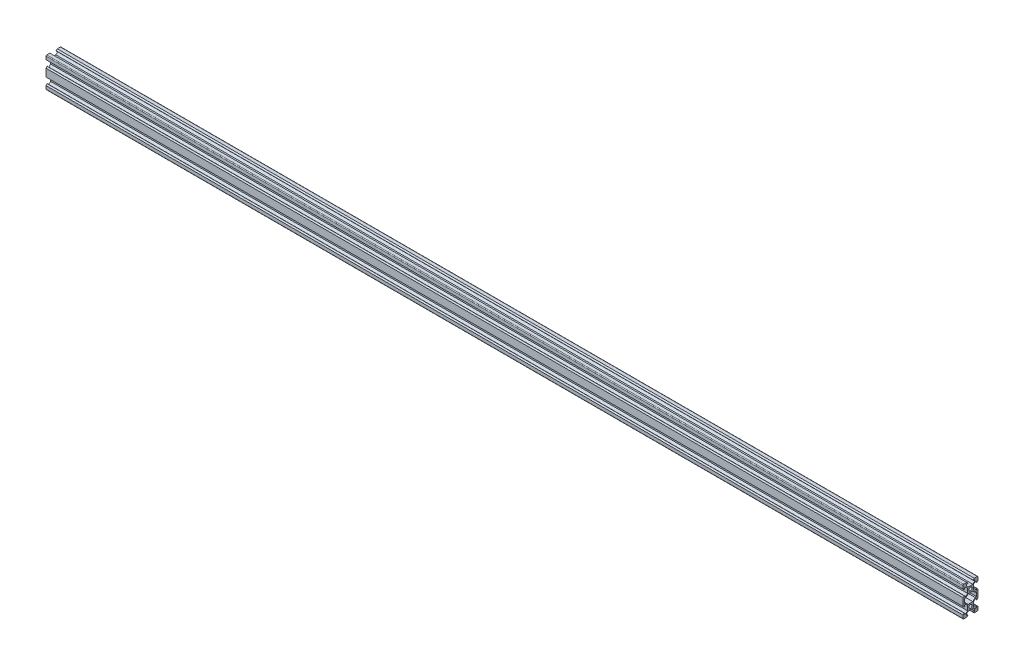
from build123d import *

# Parameters (mm, degrees)
SKETCH12_R             = 2.1
VSLOT2040_2040_2_DEPTH = 1219.2


with BuildPart() as part:
    # Sketch12 → Vslot2040 2040(2) (new body)
    with BuildSketch(Plane(origin=(-609.6, 0, 0), x_dir=(0, 0, -1), z_dir=(1, 0, 0))):
        with BuildLine():
            Line((5.5, -18.2), (3.607842712, -18.2))
            ThreePointArc((3.607842712, -18.2), (3.423066806, -18.323463314), (3.466421356, -18.541421356))
            Line((3.466421356, -18.541421356), (4.925, -20))
            Line((4.925, -20), (9, -20))
            ThreePointArc((9, -20), (9.707106781, -19.707106781), (10, -19))
            Line((10, -19), (10, -14.925))
            Line((10, -14.925), (8.541421356, -13.466421356))
            ThreePointArc((8.541421356, -13.466421356), (8.323463314, -13.423066806), (8.2, -13.607842712))
            Line((8.2, -13.607842712), (8.2, -15.5))
            Line((8.2, -15.5), (6.275, -15.5))
            Line((6.275, -15.5), (3.9, -13.125))
            Line((3.9, -13.125), (3.9, -6.875))
            Line((3.9, -6.875), (6.275, -4.5))
            Line((6.275, -4.5), (8.2, -4.5))
            Line((8.2, -4.5), (8.2, -6.392157288))
            ThreePointArc((8.2, -6.392157288), (8.323463314, -6.576933194), (8.541421356, -6.533578644))
            Line((8.541421356, -6.533578644), (10, -5.075))
            Line((10, -5.075), (10, 5.075))
            Line((10, 5.075), (8.541421356, 6.533578644))
            ThreePointArc((8.541421356, 6.533578644), (8.323463314, 6.576933194), (8.2, 6.392157288))
            Line((8.2, 6.392157288), (8.2, 4.5))
            Line((8.2, 4.5), (6.275, 4.5))
            Line((6.275, 4.5), (3.9, 6.875))
            Line((3.9, 6.875), (3.9, 13.125))
            Line((3.9, 13.125), (6.275, 15.5))
            Line((6.275, 15.5), (8.2, 15.5))
            Line((8.2, 15.5), (8.2, 13.607842712))
            ThreePointArc((8.2, 13.607842712), (8.323463314, 13.423066806), (8.541421356, 13.466421356))
            Line((8.541421356, 13.466421356), (10, 14.925))
            Line((10, 14.925), (10, 19))
            ThreePointArc((10, 19), (9.707106781, 19.707106781), (9, 20))
            Line((9, 20), (4.925, 20))
            Line((4.925, 20), (3.466421356, 18.541421356))
            ThreePointArc((3.466421356, 18.541421356), (3.423066806, 18.323463314), (3.607842712, 18.2))
            Line((3.607842712, 18.2), (5.5, 18.2))
            Line((5.5, 18.2), (5.5, 16.275))
            Line((5.5, 16.275), (3.125, 13.9))
            Line((3.125, 13.9), (-3.125, 13.9))
            Line((-3.125, 13.9), (-5.5, 16.275))
            Line((-5.5, 16.275), (-5.5, 18.2))
            Line((-5.5, 18.2), (-3.607842712, 18.2))
            ThreePointArc((-3.607842712, 18.2), (-3.423066806, 18.323463314), (-3.466421356, 18.541421356))
            Line((-3.466421356, 18.541421356), (-4.925, 20))
            Line((-4.925, 20), (-9, 20))
            ThreePointArc((-9, 20), (-9.707106781, 19.707106781), (-10, 19))
            Line((-10, 19), (-10, 14.925))
            Line((-10, 14.925), (-8.541421356, 13.466421356))
            ThreePointArc((-8.541421356, 13.466421356), (-8.323463314, 13.423066806), (-8.2, 13.607842712))
            Line((-8.2, 13.607842712), (-8.2, 15.5))
            Line((-8.2, 15.5), (-6.275, 15.5))
            Line((-6.275, 15.5), (-3.9, 13.125))
            Line((-3.9, 13.125), (-3.9, 6.875))
            Line((-3.9, 6.875), (-6.275, 4.5))
            Line((-6.275, 4.5), (-8.2, 4.5))
            Line((-8.2, 4.5), (-8.2, 6.392157288))
            ThreePointArc((-8.2, 6.392157288), (-8.323463314, 6.576933194), (-8.541421356, 6.533578644))
            Line((-8.541421356, 6.533578644), (-10, 5.075))
            Line((-10, 5.075), (-10, -5.075))
            Line((-10, -5.075), (-8.541421356, -6.533578644))
            ThreePointArc((-8.541421356, -6.533578644), (-8.323463314, -6.576933194), (-8.2, -6.392157288))
            Line((-8.2, -6.392157288), (-8.2, -4.5))
            Line((-8.2, -4.5), (-6.275, -4.5))
            Line((-6.275, -4.5), (-3.9, -6.875))
            Line((-3.9, -6.875), (-3.9, -13.125))
            Line((-3.9, -13.125), (-6.275, -15.5))
            Line((-6.275, -15.5), (-8.2, -15.5))
            Line((-8.2, -15.5), (-8.2, -13.607842712))
            ThreePointArc((-8.2, -13.607842712), (-8.323463314, -13.423066806), (-8.541421356, -13.466421356))
            Line((-8.541421356, -13.466421356), (-10, -14.925))
            Line((-10, -14.925), (-10, -19))
            ThreePointArc((-10, -19), (-9.707106781, -19.707106781), (-9, -20))
            Line((-9, -20), (-4.925, -20))
            Line((-4.925, -20), (-3.466421356, -18.541421356))
            ThreePointArc((-3.466421356, -18.541421356), (-3.423066806, -18.323463314), (-3.607842712, -18.2))
            Line((-3.607842712, -18.2), (-5.5, -18.2))
            Line((-5.5, -18.2), (-5.5, -16.275))
            Line((-5.5, -16.275), (-3.125, -13.9))
            Line((-3.125, -13.9), (3.125, -13.9))
            Line((3.125, -13.9), (5.5, -16.275))
            Line((5.5, -16.275), (5.5, -18.2))
        make_face()
        with Locations((0, -10)):
            Circle(SKETCH12_R, mode=Mode.SUBTRACT)
        with Locations((0, 10)):
            Circle(SKETCH12_R, mode=Mode.SUBTRACT)
        Polygon((3.125, 6.1), (6.275, 2.95), (8.2, 2.95), (8.2, -2.95), (6.275, -2.95), (3.125, -6.1), (-3.125, -6.1), (-6.275, -2.95), (-8.2, -2.95), (-8.2, 2.95), (-6.275, 2.95), (-3.125, 6.1), align=None, mode=Mode.SUBTRACT)
    extrude(amount=VSLOT2040_2040_2_DEPTH)


solid = part.part
